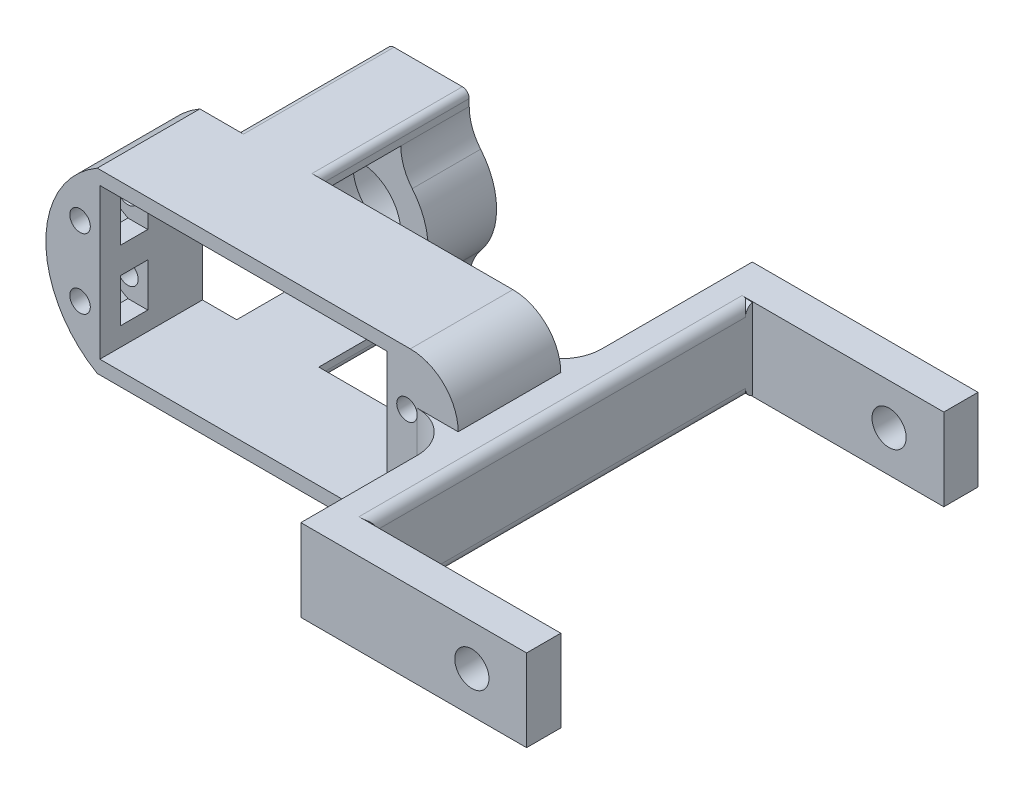
from build123d import *

# Parameters (mm, degrees)
ESQUISSE1_W                   = 80
ESQUISSE1_H                   = 26
BOSS_EXTRU_1_DEPTH            = 5
ESQUISSE4_W                   = 15
ESQUISSE4_H                   = 21
BOSS_EXTRU_2_DEPTH            = 23
ESQUISSE6_R                   = 1.9
ENL_V_MAT_EXTRU_1_DEPTH       = 23
ESQUISSE7_R                   = 2.5
ENL_V_MAT_EXTRU_2_DEPTH       = 33
ESQUISSE8_W                   = 23.844388633
ESQUISSE8_H                   = 15
ENL_V_MAT_EXTRU_3_DEPTH       = 20
ENL_V_MAT_EXTRU_4_DEPTH       = 20
ENL_V_MAT_EXTRU_5_DEPTH       = 25
ENL_V_MAT_EXTRU_7_DEPTH       = 25
ENL_V_MAT_EXTRU_8_DEPTH       = 1
BOSS_EXTRU_3_DEPTH            = 2
ESQUISSE15_R                  = 1.5
ENL_V_MAT_EXTRU_9_DEPTH       = 19
ENL_V_MAT_EXTRU_10_DEPTH      = 19
ESQUISSE17_W                  = 42
ESQUISSE17_H                  = 22
ENL_V_MAT_EXTRU_11_DEPTH      = 19
ENL_V_MAT_EXTRU_12_DEPTH      = 2
BOSS_EXTRU_4_DEPTH            = 22
BOSS_EXTRU_5_DEPTH            = 10
ESQUISSE25_R                  = 8
ENL_V_MAT_EXTRU_13_DEPTH      = 5
ESQUISSE26_R                  = 6
ENL_V_MAT_EXTRU_14_DEPTH      = 5
ENL_V_MAT_EXTRU_15_DEPTH      = 1
BOSS_EXTRU_6_DEPTH            = 2
ENL_V_MAT_EXTRU_16_DEPTH      = 25
ENL_V_MAT_EXTRU_16_DEPTH_BACK = 25
BOSS_EXTRU_7_START            = -5
BOSS_EXTRU_7_DEPTH            = 5
BOSS_EXTRU_8_DEPTH            = 23
BOSS_EXTRU_8_DEPTH_BACK       = 43
BOSS_EXTRU_10_DEPTH           = 45
BOSS_EXTRU_10_DEPTH_BACK      = 3
BOSS_EXTRU_12_DEPTH           = 5
ENL_V_START                   = -45
ENL_V_MAT_EXTRU_18_DEPTH      = 45
ESQUISSE41_W                  = 5
ESQUISSE41_H                  = 12
BOSS_EXTRU_13_DEPTH           = 37
ENL_V_MAT_EXTRU_19_DEPTH      = 2
ESQUISSE43_R                  = 2
ENL_V_MAT_EXTRU_20_DEPTH      = 18
ESQUISSE44_W                  = 24.601862261
ESQUISSE44_H                  = 37.157295415
ENL_V_MAT_EXTRU_21_DEPTH      = 18
BOSS_EXTRU_14_START           = -5
ESQUISSE45_R                  = 1.5
ESQUISSE45_R_2                = 1
BOSS_EXTRU_14_DEPTH           = 5
ENL_V_START_2                 = -29
ENL_V_MAT_EXTRU_22_DEPTH      = 29
ESQUISSE47_W                  = 0.149289857
ESQUISSE47_H                  = 9
ENL_V_MAT_EXTRU_23_DEPTH      = 1
ENL_V_MAT_EXTRU_24_DEPTH      = 21
ENL_V_MAT_EXTRU_24_DEPTH_BACK = 15
ESQUISSE48_W                  = 0.149289857
ESQUISSE48_H                  = 1
ENL_V_MAT_EXTRU_25_DEPTH      = 21
BOSS_EXTRU_15_DEPTH           = 12
ENL_V_MAT_EXTRU_26_DEPTH      = 13
ENL_V_MAT_EXTRU_26_DEPTH_BACK = 2
BOSS_EXTRU_16_DEPTH           = 2
ESQUISSE53_W                  = 7.470970304
ESQUISSE53_H                  = 6.350852961
ESQUISSE53_W_2                = 7.513906915
ESQUISSE53_W_3                = 7.72858997
ESQUISSE53_W_4                = 7.91407613
ENL_V_MAT_EXTRU_27_DEPTH      = 4
BOSS_EXTRU_17_DEPTH           = 8
BOSS_EXTRU_18_DEPTH           = 8
BOSS_EXTRU_19_DEPTH           = 12
ENL_V_START_3                 = -10
ESQUISSE58_R                  = 1.5
ENL_V_MAT_EXTRU_28_DEPTH      = 10
ENL_V_MAT_EXTRU_29_DEPTH      = 136.545455903
ENL_V_MAT_EXTRU_29_DEPTH_BACK = 136.545455903
ESQUISSE59_R                  = 2.5
ENL_V_MAT_EXTRU_30_DEPTH      = 136.545455903
ENL_V_MAT_EXTRU_30_DEPTH_BACK = 136.545455903
ESQUISSE60_W                  = 50
ESQUISSE60_H                  = 50


with BuildPart() as part:
    # Esquisse1 → Boss.-Extru.1 (new body)
    with BuildSketch(Plane.XY):
        with Locations((16.761307699, -3.439862543)):
            Rectangle(ESQUISSE1_W, ESQUISSE1_H)
    extrude(amount=BOSS_EXTRU_1_DEPTH)

    # Esquisse4 → Boss.-Extru.2 (add)
    with BuildSketch(Plane(origin=(0, 0, 0), x_dir=(-1, 0, 0), z_dir=(0, 0, -1))):
        with Locations((30.738692301, -3.439862543)):
            Rectangle(ESQUISSE4_W, ESQUISSE4_H)
    extrude(amount=-BOSS_EXTRU_2_DEPTH)

    # Esquisse6 → Enlèv. mat.-Extru.1 (cut)
    with BuildSketch(Plane.XZ.offset(13.939862543)):
        with Locations((-28.738692301, 5)):
            Circle(ESQUISSE6_R)
    extrude(amount=-ENL_V_MAT_EXTRU_1_DEPTH, mode=Mode.SUBTRACT)

    # Esquisse7 → Enlèv. mat.-Extru.2 (cut)
    with BuildSketch(Plane.XY.offset(23)):
        with Locations((-33.238692301, -3.439862543)):
            Circle(ESQUISSE7_R)
    extrude(amount=-ENL_V_MAT_EXTRU_2_DEPTH, mode=Mode.SUBTRACT)

    # Esquisse8 → Enlèv. mat.-Extru.3 (cut)
    with BuildSketch(Plane(origin=(0, 0, 0), x_dir=(-1, 0, 0), z_dir=(0, 0, -1))):
        with Locations((38.160886617, -3.439862543)):
            Rectangle(ESQUISSE8_W, ESQUISSE8_H)
    extrude(amount=-ENL_V_MAT_EXTRU_3_DEPTH, mode=Mode.SUBTRACT)

    # Esquisse9 → Enlèv. mat.-Extru.4 (cut)
    with BuildSketch(Plane(origin=(0, 0, 0), x_dir=(-1, 0, 0), z_dir=(0, 0, -1))):
        with BuildLine():
            Line((23.238692301, 7.060137457), (23.238692301, 9.560137457))
            Line((23.238692301, 9.560137457), (17.813492819, 9.560137457))
            ThreePointArc((17.813492819, 9.560137457), (20.800246467, 8.905073311), (23.238692301, 7.060137457))
        make_face()
        with BuildLine():
            Line((17.813492819, -16.439862543), (23.238692301, -16.439862543))
            Line((23.238692301, -16.439862543), (23.238692301, -13.939862543))
            ThreePointArc((23.238692301, -13.939862543), (20.800246467, -15.784798397), (17.813492819, -16.439862543))
        make_face()
    extrude(amount=-ENL_V_MAT_EXTRU_4_DEPTH, mode=Mode.SUBTRACT)

    # Esquisse10 → Enlèv. mat.-Extru.5 (cut)
    with BuildSketch(Plane.XZ.offset(13.939862543)):
        with BuildLine():
            Line((-23.238692301, 21.5), (-23.238692301, 23))
            Line((-23.238692301, 23), (-24.738692301, 23))
            ThreePointArc((-24.738692301, 23), (-23.678032129, 22.560660172), (-23.238692301, 21.5))
        make_face()
    extrude(amount=-ENL_V_MAT_EXTRU_5_DEPTH, mode=Mode.SUBTRACT)

    # Esquisse12 → Enlèv. mat.-Extru.7 (cut)
    with BuildSketch(Plane.XZ.offset(13.939862543)):
        with BuildLine():
            Line((-38.238692301, 23), (-36.738692301, 23))
            ThreePointArc((-36.738692301, 23), (-37.799352472, 22.560660172), (-38.238692301, 21.5))
            Line((-38.238692301, 21.5), (-38.238692301, 23))
        make_face()
    extrude(amount=-ENL_V_MAT_EXTRU_7_DEPTH, mode=Mode.SUBTRACT)

    # Esquisse13 → Enlèv. mat.-Extru.8 (cut)
    with BuildSketch(Plane(origin=(0, 7.060137457, 0), x_dir=(1, 0, 0), z_dir=(0, 1, 0))):
        Polygon((-30.759418243, -1.5), (-32.780144185, -5), (-30.759418243, -8.5), (-26.717966358, -8.5), (-24.697240416, -5), (-26.717966358, -1.5), align=None)
    extrude(amount=-ENL_V_MAT_EXTRU_8_DEPTH, mode=Mode.SUBTRACT)

    # Esquisse14 → Boss.-Extru.3 (add)
    with BuildSketch(Plane(origin=(0, 7.060137457, 0), x_dir=(1, 0, 0), z_dir=(0, 1, 0))):
        Polygon((-25.851940955, 0), (-31.625443646, 0), (-34.512194992, -5), (-31.625443646, -10), (-25.851940955, -10), (-23.238692301, -5.473720558), (-23.238692301, -4.526279442), align=None)
        Polygon((-30.759418243, -1.5), (-32.780144185, -5), (-30.759418243, -8.5), (-26.717966358, -8.5), (-24.697240416, -5), (-26.717966358, -1.5), align=None, mode=Mode.SUBTRACT)
    extrude(amount=BOSS_EXTRU_3_DEPTH)

    # Esquisse15 → Enlèv. mat.-Extru.9 (cut)
    with BuildSketch(Plane(origin=(0, 0, 0), x_dir=(-1, 0, 0), z_dir=(0, 0, -1))):
        with Locations((-51.761307699, -8.539862543)):
            Circle(ESQUISSE15_R)
        with Locations((-51.761307699, 1.660137457)):
            Circle(ESQUISSE15_R)
        with Locations((-3.961307699, -8.539862543)):
            Circle(ESQUISSE15_R)
        with Locations((-3.961307699, 1.660137457)):
            Circle(ESQUISSE15_R)
    extrude(amount=-ENL_V_MAT_EXTRU_9_DEPTH, mode=Mode.SUBTRACT)

    # Esquisse16 → Enlèv. mat.-Extru.10 (cut)
    with BuildSketch(Plane(origin=(0, 0, 0), x_dir=(-1, 0, 0), z_dir=(0, 0, -1))):
        with BuildLine():
            Line((-43.376442757, 11.472928569), (-43.376442757, 11.560137457))
            Line((-43.376442757, 11.560137457), (-70.792344678, 11.560137457))
            Line((-70.792344678, 11.560137457), (-70.792344678, -43.134117635))
            Line((-70.792344678, -43.134117635), (-43.376442757, -43.134117635))
            Line((-43.376442757, -43.134117635), (-43.376442757, -18.352653655))
            ThreePointArc((-43.376442757, -18.352653655), (-56.761307699, -3.439862543), (-43.376442757, 11.472928569))
        make_face()
    extrude(amount=-ENL_V_MAT_EXTRU_10_DEPTH, mode=Mode.SUBTRACT)

    # Esquisse17 → Enlèv. mat.-Extru.11 (cut)
    with BuildSketch(Plane.XY.offset(5)):
        with Locations((27.861307699, -3.439862543)):
            Rectangle(ESQUISSE17_W, ESQUISSE17_H)
    extrude(amount=-ENL_V_MAT_EXTRU_11_DEPTH, mode=Mode.SUBTRACT)

    # Esquisse18 → Enlèv. mat.-Extru.12 (cut)
    with BuildSketch(Plane(origin=(0, 0, 0), x_dir=(-1, 0, 0), z_dir=(0, 0, -1))):
        Polygon((-49.011307699, 3.247850697), (-51.761307699, 4.835563938), (-54.511307699, 3.247850697), (-54.511307699, 0.072424217), (-51.761307699, -1.515289023), (-49.011307699, 0.072424217), (-46.261307699, 1.660137457), align=None)
        Polygon((-49.011307699, -6.952149303), (-51.761307699, -5.364436062), (-54.511307699, -6.952149303), (-54.511307699, -10.127575783), (-51.761307699, -11.715289023), (-49.011307699, -10.127575783), (-46.261307699, -8.539862543), align=None)
        Polygon((-6.711307699, 0.072424217), (-9.461307699, 1.660137457), (-6.711307699, 3.247850697), (-3.961307699, 4.835563938), (-1.211307699, 3.247850697), (-1.211307699, 0.072424217), (-3.961307699, -1.515289023), align=None)
        Polygon((-9.461307699, -8.539862543), (-6.711307699, -6.952149303), (-3.961307699, -5.364436062), (-1.211307699, -6.952149303), (-1.211307699, -10.127575783), (-3.961307699, -11.715289023), (-6.711307699, -10.127575783), align=None)
    extrude(amount=-ENL_V_MAT_EXTRU_12_DEPTH, mode=Mode.SUBTRACT)

    # Esquisse19 → Boss.-Extru.4 (add)
    with BuildSketch(Plane(origin=(0, 0, 0), x_dir=(-1, 0, 0), z_dir=(0, 0, -1))):
        with BuildLine():
            Line((-12.861307699, -16.439862543), (-22.861307699, -16.439862543))
            ThreePointArc((-22.861307699, -16.439862543), (-23.568414481, -16.146969324), (-23.861307699, -15.439862543))
            Line((-23.861307699, -15.439862543), (-23.861307699, -14.439862543))
            Line((-23.861307699, -14.439862543), (-11.861307699, -14.439862543))
            Line((-11.861307699, -14.439862543), (-11.861307699, -15.439862543))
            ThreePointArc((-11.861307699, -15.439862543), (-12.154200918, -16.146969324), (-12.861307699, -16.439862543))
        make_face()
        with BuildLine():
            Line((-23.861307699, 8.560137457), (-23.861307699, 7.560137457))
            Line((-23.861307699, 7.560137457), (-11.861307699, 7.560137457))
            Line((-11.861307699, 7.560137457), (-11.861307699, 8.560137457))
            ThreePointArc((-11.861307699, 8.560137457), (-12.154200918, 9.267244238), (-12.861307699, 9.560137457))
            Line((-12.861307699, 9.560137457), (-22.861307699, 9.560137457))
            ThreePointArc((-22.861307699, 9.560137457), (-23.568414481, 9.267244238), (-23.861307699, 8.560137457))
        make_face()
    extrude(amount=BOSS_EXTRU_4_DEPTH)

    # Esquisse23 → Boss.-Extru.5 (add)
    with BuildSketch(Plane(origin=(0, 0, -22), x_dir=(-1, 0, 0), z_dir=(0, 0, -1))):
        with BuildLine():
            Line((-23.861307699, 8.560137457), (-23.861307699, 7.560137457))
            ThreePointArc((-23.861307699, 7.560137457), (-24.290279557, 5.125218133), (-25.525541276, 2.983495121))
            ThreePointArc((-25.525541276, 2.983495121), (-27.861307699, -3.439862543), (-25.525541276, -9.863220207))
            ThreePointArc((-25.525541276, -9.863220207), (-24.290279557, -12.004943218), (-23.861307699, -14.439862543))
            Line((-23.861307699, -14.439862543), (-23.861307699, -15.439862543))
            ThreePointArc((-23.861307699, -15.439862543), (-23.568414481, -16.146969324), (-22.861307699, -16.439862543))
            Line((-22.861307699, -16.439862543), (-12.861307699, -16.439862543))
            ThreePointArc((-12.861307699, -16.439862543), (-12.154200918, -16.146969324), (-11.861307699, -15.439862543))
            Line((-11.861307699, -15.439862543), (-11.861307699, -14.439862543))
            ThreePointArc((-11.861307699, -14.439862543), (-11.432335842, -12.004943218), (-10.197074123, -9.863220207))
            ThreePointArc((-10.197074123, -9.863220207), (-7.861307699, -3.439862543), (-10.197074123, 2.983495121))
            ThreePointArc((-10.197074123, 2.983495121), (-11.432335842, 5.125218133), (-11.861307699, 7.560137457))
            Line((-11.861307699, 7.560137457), (-11.861307699, 8.560137457))
            ThreePointArc((-11.861307699, 8.560137457), (-12.154200918, 9.267244238), (-12.861307699, 9.560137457))
            Line((-12.861307699, 9.560137457), (-22.861307699, 9.560137457))
            ThreePointArc((-22.861307699, 9.560137457), (-23.568414481, 9.267244238), (-23.861307699, 8.560137457))
        make_face()
    extrude(amount=BOSS_EXTRU_5_DEPTH)

    # Esquisse25 → Enlèv. mat.-Extru.13 (cut)
    with BuildSketch(Plane(origin=(0, 0, -32), x_dir=(-1, 0, 0), z_dir=(0, 0, -1))):
        with Locations((-17.861307699, -3.439862543)):
            Circle(ESQUISSE25_R)
    extrude(amount=-ENL_V_MAT_EXTRU_13_DEPTH, mode=Mode.SUBTRACT)

    # Esquisse26 → Enlèv. mat.-Extru.14 (cut)
    with BuildSketch(Plane(origin=(0, 0, -27), x_dir=(-1, 0, 0), z_dir=(0, 0, -1))):
        with Locations((-17.861307699, -3.439862543)):
            Circle(ESQUISSE26_R)
    extrude(amount=-ENL_V_MAT_EXTRU_14_DEPTH, mode=Mode.SUBTRACT)

    # Esquisse29 → Enlèv. mat.-Extru.15 (cut)
    with BuildSketch(Plane.XZ.offset(13.939862543)):
        Polygon((-26.717966358, 1.5), (-24.697240416, 5), (-26.717966358, 8.5), (-30.759418243, 8.5), (-32.780144185, 5), (-30.759418243, 1.5), align=None)
    extrude(amount=-ENL_V_MAT_EXTRU_15_DEPTH, mode=Mode.SUBTRACT)

    # Esquisse32 → Boss.-Extru.6 (add)
    with BuildSketch(Plane.XZ.offset(13.939862543)):
        Polygon((-25.851940955, 0), (-23.238692301, 4.526279442), (-23.238692301, 5.473720558), (-25.851940955, 10), (-31.625443646, 10), (-34.512194992, 5), (-31.625443646, 0), align=None)
        Polygon((-26.717966358, 1.5), (-24.697240416, 5), (-26.717966358, 8.5), (-30.759418243, 8.5), (-32.780144185, 5), (-30.759418243, 1.5), align=None, mode=Mode.SUBTRACT)
    extrude(amount=BOSS_EXTRU_6_DEPTH)

    # Esquisse33 → Enlèv. mat.-Extru.16 (cut, two sides: drawn at the far end of the back side and taken through both)
    with BuildSketch(Plane.XY.offset(5).offset(-ENL_V_MAT_EXTRU_16_DEPTH_BACK)):
        with BuildLine():
            Line((6.477992926, -16.439862543), (-54.7028229, -16.439862543))
            Line((-54.7028229, -16.439862543), (-54.7028229, 9.560137457))
            Line((-54.7028229, 9.560137457), (6.477992926, 9.560137457))
            ThreePointArc((6.477992926, 9.560137457), (-1.038692301, -3.439862543), (6.477992926, -16.439862543))
        make_face()
    extrude(amount=ENL_V_MAT_EXTRU_16_DEPTH + ENL_V_MAT_EXTRU_16_DEPTH_BACK, mode=Mode.SUBTRACT)

    # Esquisse34 → Boss.-Extru.7 (add)
    with BuildSketch(Plane.XY.offset(5).offset(BOSS_EXTRU_7_START)):
        with BuildLine():
            Line((59.244622473, -16.439862543), (49.244622473, -16.439862543))
            ThreePointArc((49.244622473, -16.439862543), (56.761307699, -3.439862543), (49.244622473, 9.560137457))
            Line((49.244622473, 9.560137457), (59.244622473, 9.560137457))
            Line((59.244622473, 9.560137457), (59.244622473, -16.439862543))
        make_face()
    extrude(amount=BOSS_EXTRU_7_DEPTH)

    # Esquisse35 → Boss.-Extru.8 (add, two sides: drawn at the far end of the back side and taken through both)
    with BuildSketch(Plane.XY.offset(5).offset(-BOSS_EXTRU_8_DEPTH_BACK)):
        with BuildLine():
            Line((62.744622473, -9.439862543), (59.244622473, -9.439862543))
            Line((59.244622473, -9.439862543), (59.244622473, 2.560137457))
            Line((59.244622473, 2.560137457), (62.744622473, 2.560137457))
            ThreePointArc((62.744622473, 2.560137457), (63.805282645, 2.120797629), (64.244622473, 1.060137457))
            Line((64.244622473, 1.060137457), (64.244622473, -7.939862543))
            ThreePointArc((64.244622473, -7.939862543), (63.805282645, -9.000522715), (62.744622473, -9.439862543))
        make_face()
    extrude(amount=BOSS_EXTRU_8_DEPTH + BOSS_EXTRU_8_DEPTH_BACK)

    # Esquisse36 → Boss.-Extru.10 (add, two sides: drawn at the far end of the back side and taken through both)
    with BuildSketch(Plane(origin=(64.244622473, 0, 0), x_dir=(0, 0, -1), z_dir=(1, 0, 0)).offset(-BOSS_EXTRU_10_DEPTH_BACK)):
        with BuildLine():
            Line((33.5, 2.560137457), (38, 2.560137457))
            Line((38, 2.560137457), (38, -9.439862543))
            Line((38, -9.439862543), (33.5, -9.439862543))
            ThreePointArc((33.5, -9.439862543), (32.439339828, -9.000522715), (32, -7.939862543))
            Line((32, -7.939862543), (32, 1.060137457))
            ThreePointArc((32, 1.060137457), (32.439339828, 2.120797629), (33.5, 2.560137457))
        make_face()
        with BuildLine():
            Line((-28, 2.560137457), (-28, -9.439862543))
            Line((-28, -9.439862543), (-23.5, -9.439862543))
            ThreePointArc((-23.5, -9.439862543), (-22.439339828, -9.000522715), (-22, -7.939862543))
            Line((-22, -7.939862543), (-22, 1.060137457))
            ThreePointArc((-22, 1.060137457), (-22.439339828, 2.120797629), (-23.5, 2.560137457))
            Line((-23.5, 2.560137457), (-28, 2.560137457))
        make_face()
    extrude(amount=BOSS_EXTRU_10_DEPTH + BOSS_EXTRU_10_DEPTH_BACK)

    # Esquisse39 → Boss.-Extru.12 (add)
    with BuildSketch(Plane(origin=(0, 0, -38), x_dir=(-1, 0, 0), z_dir=(0, 0, -1))):
        with BuildLine():
            Line((-77.712666699, 2.560137457), (-100.293632227, 2.560137457))
            add(Edge.make_bspline(
                [(-101.462740863, -1.584513895), (-99.224121261, -2.268014786), (-102.465356223, 2.979290843), (-100.293632227, 2.560137457)],
                knots=[0, 0, 0, 0, 0.141370549, 0.141370549, 0.141370549, 0.141370549], degree=3))
            ThreePointArc((-101.462740863, -1.584513895), (-117.244622473, -3.439862543), (-101.462740863, -5.295211191))
            add(Edge.make_bspline(
                [(-101.462740863, -5.295211191), (-99.224121261, -4.6117103), (-102.465356223, -9.859015928), (-100.293632227, -9.439862543)],
                knots=[0, 0, 0, 0, 0.141370549, 0.141370549, 0.141370549, 0.141370549], degree=3))
            Line((-100.293632227, -9.439862543), (-77.712666699, -9.439862543))
            Line((-77.712666699, -9.439862543), (-77.712666699, 2.560137457))
        make_face()
    extrude(amount=-BOSS_EXTRU_12_DEPTH)

    # Esquisse40 → Enlèv. mat.-Extru.18 (cut)
    with BuildSketch(Plane(origin=(109.244622473, 0, 0), x_dir=(0, 0, -1), z_dir=(1, 0, 0)).offset(ENL_V_START)):
        with BuildLine():
            Line((32, 1.060137457), (32, -7.939862543))
            ThreePointArc((32, -7.939862543), (32.275255129, -8.805887947), (33, -9.354076105))
            Line((33, -9.354076105), (33, 2.474351019))
            ThreePointArc((33, 2.474351019), (32.275255129, 1.926162861), (32, 1.060137457))
        make_face()
    extrude(amount=ENL_V_MAT_EXTRU_18_DEPTH, mode=Mode.SUBTRACT)

    # Esquisse41 → Boss.-Extru.13 (add)
    with BuildSketch(Plane.ZY.offset(-59.244622473)):
        with Locations((-35.5, -3.439862543)):
            Rectangle(ESQUISSE41_W, ESQUISSE41_H)
    extrude(amount=-BOSS_EXTRU_13_DEPTH)

    # Esquisse42 → Enlèv. mat.-Extru.19 (cut)
    with BuildSketch(Plane.XY.offset(-33)):
        Polygon((105.744622473, -5.460588485), (109.244622473, -7.481314427), (112.744622473, -5.460588485), (112.744622473, -1.419136601), (109.244622473, 0.601589341), (105.744622473, -1.419136601), align=None)
    extrude(amount=-ENL_V_MAT_EXTRU_19_DEPTH, mode=Mode.SUBTRACT)

    # Esquisse43 → Enlèv. mat.-Extru.20 (cut)
    with BuildSketch(Plane(origin=(0, 0, -38), x_dir=(-1, 0, 0), z_dir=(0, 0, -1))):
        with Locations((-109.244622473, -3.439862543)):
            Circle(ESQUISSE43_R)
    extrude(amount=-ENL_V_MAT_EXTRU_20_DEPTH, mode=Mode.SUBTRACT)

    # Esquisse44 → Enlèv. mat.-Extru.21 (cut)
    with BuildSketch(Plane.XY.offset(28)):
        with Locations((105.694843461, -5.730380753)):
            Rectangle(ESQUISSE44_W, ESQUISSE44_H)
    extrude(amount=-ENL_V_MAT_EXTRU_21_DEPTH, mode=Mode.SUBTRACT)

    # Esquisse45 → Boss.-Extru.14 (add)
    with BuildSketch(Plane.XY.offset(28).offset(BOSS_EXTRU_14_START)):
        with BuildLine():
            Line((63.244622473, 2.474351019), (64.244622473, 2.474351019))
            Line((64.244622473, 2.474351019), (64.244622473, -9.354076105))
            Line((64.244622473, -9.354076105), (63.244622473, -9.354076105))
            ThreePointArc((63.244622473, -9.354076105), (62.998275441, -9.418260382), (62.744622473, -9.439862543))
            Line((62.744622473, -9.439862543), (100.293632227, -9.439862543))
            add(Edge.make_bspline(
                [(100.293632227, -9.439862543), (100.565101811, -9.492257504), (100.751991366, -9.45611138), (100.875576879, -9.3540761)],
                knots=[0.123698964, 0.123698964, 0.123698964, 0.123698964, 0.141370549, 0.141370549, 0.141370549, 0.141370549], degree=3))
            Line((100.875576879, -9.3540761), (103.857408171, -9.354076105))
            ThreePointArc((103.857408171, -9.354076105), (117.244622473, -3.439862543), (103.857408171, 2.474351019))
            Line((103.857408171, 2.474351019), (100.875576879, 2.474351014))
            add(Edge.make_bspline(
                [(100.875576879, 2.474351014), (100.751991366, 2.576386294), (100.565101811, 2.612532419), (100.293632227, 2.560137457)],
                knots=[0, 0, 0, 0, 0.017671584, 0.017671584, 0.017671584, 0.017671584], degree=3))
            Line((100.293632227, 2.560137457), (62.744622473, 2.560137457))
            ThreePointArc((62.744622473, 2.560137457), (62.998275441, 2.538535297), (63.244622473, 2.474351019))
        make_face()
        with Locations((109.244622473, -3.439862543)):
            Circle(ESQUISSE45_R, mode=Mode.SUBTRACT)
        with Locations((98.894622473, -3.439862543)):
            Circle(ESQUISSE45_R_2, mode=Mode.SUBTRACT)
    extrude(amount=BOSS_EXTRU_14_DEPTH)

    # Esquisse46 → Enlèv. mat.-Extru.22 (cut)
    with BuildSketch(Plane(origin=(93.39391233, 0, 0), x_dir=(0, 0, -1), z_dir=(1, 0, 0)).offset(ENL_V_START_2)):
        with BuildLine():
            Line((-23, 2.474351019), (-23, -9.354076105))
            ThreePointArc((-23, -9.354076105), (-22.275255129, -8.805887947), (-22, -7.939862543))
            Line((-22, -7.939862543), (-22, 1.060137457))
            ThreePointArc((-22, 1.060137457), (-22.275255129, 1.926162861), (-23, 2.474351019))
        make_face()
    extrude(amount=ENL_V_MAT_EXTRU_22_DEPTH, mode=Mode.SUBTRACT)

    # Esquisse47 → Enlèv. mat.-Extru.23 (cut)
    with BuildSketch(Plane(origin=(0, 0, 22), x_dir=(-1, 0, 0), z_dir=(0, 0, -1))):
        with Locations((-64.319267402, -3.439862543)):
            Rectangle(ESQUISSE47_W, ESQUISSE47_H)
    extrude(amount=-ENL_V_MAT_EXTRU_23_DEPTH, mode=Mode.SUBTRACT)

    # Esquisse48 → Enlèv. mat.-Extru.24 (cut, two sides: drawn at the far end of the back side and taken through both)
    with BuildSketch(Plane.XZ.offset(-1.060137457).offset(-ENL_V_MAT_EXTRU_24_DEPTH_BACK)):
        with Locations((64.319267402, 22.5)):
            Rectangle(ESQUISSE48_W, ESQUISSE48_H)
    extrude(amount=ENL_V_MAT_EXTRU_24_DEPTH + ENL_V_MAT_EXTRU_24_DEPTH_BACK, mode=Mode.SUBTRACT)

    # Esquisse49 → Enlèv. mat.-Extru.25 (cut)
    with BuildSketch(Plane.XY.offset(5)):
        with BuildLine():
            Line((59.244622473, -9.439862543), (59.244622473, -16.439862543))
            Line((59.244622473, -16.439862543), (52.244622473, -16.439862543))
            ThreePointArc((52.244622473, -16.439862543), (57.194369941, -14.389610011), (59.244622473, -9.439862543))
        make_face()
        with BuildLine():
            Line((59.244622473, 9.560137457), (52.244622473, 9.560137457))
            ThreePointArc((52.244622473, 9.560137457), (57.194369941, 7.509884925), (59.244622473, 2.560137457))
            Line((59.244622473, 2.560137457), (59.244622473, 9.560137457))
        make_face()
    extrude(amount=-ENL_V_MAT_EXTRU_25_DEPTH, mode=Mode.SUBTRACT)

    # Esquisse50 → Boss.-Extru.15 (add)
    with BuildSketch(Plane(origin=(0, 2.560137457, 0), x_dir=(1, 0, 0), z_dir=(0, 1, 0))):
        with BuildLine():
            Line((59.244622473, 5.983314774), (59.244622473, -10.983314774))
            ThreePointArc((59.244622473, -10.983314774), (57.49215015, -6.752472323), (53.261307699, -5))
            Line((53.261307699, -5), (53.261307699, 0))
            ThreePointArc((53.261307699, 0), (57.49215015, 1.752472323), (59.244622473, 5.983314774))
        make_face()
    extrude(amount=-BOSS_EXTRU_15_DEPTH)

    # Esquisse51 → Enlèv. mat.-Extru.26 (cut, two sides: drawn at the far end of the back side and taken through both)
    with BuildSketch(Plane(origin=(0, 0, 0), x_dir=(-1, 0, 0), z_dir=(0, 0, -1)).offset(-ENL_V_MAT_EXTRU_26_DEPTH_BACK)):
        Polygon((-49.011307699, -10.127575783), (-49.011307699, -6.952149303), (-51.761307699, -5.364436062), (-54.511307699, -6.952149303), (-54.511307699, -10.127575783), (-51.761307699, -11.715289023), align=None)
        Polygon((-49.011307699, 3.247850697), (-51.761307699, 4.835563938), (-54.511307699, 3.247850697), (-54.511307699, 0.072424217), (-51.761307699, -1.515289023), (-49.011307699, 0.072424217), align=None)
    extrude(amount=ENL_V_MAT_EXTRU_26_DEPTH + ENL_V_MAT_EXTRU_26_DEPTH_BACK, mode=Mode.SUBTRACT)

    # Esquisse52 → Boss.-Extru.16 (add)
    with BuildSketch(Plane(origin=(0, 0, 0), x_dir=(-1, 0, 0), z_dir=(0, 0, -1))):
        with BuildLine():
            Line((-59.244622473, 2.560137457), (-54.511307699, 2.560137457))
            Line((-54.511307699, 2.560137457), (-54.511307699, 3.247850697))
            Line((-54.511307699, 3.247850697), (-51.761307699, 4.835563938))
            Line((-51.761307699, 4.835563938), (-48.861307699, 3.161248157))
            Line((-48.861307699, 3.161248157), (-48.861307699, 7.560137457))
            Line((-48.861307699, 7.560137457), (-23.861307699, 7.560137457))
            Line((-23.861307699, 7.560137457), (-23.861307699, 8.560137457))
            ThreePointArc((-23.861307699, 8.560137457), (-23.568414481, 9.267244238), (-22.861307699, 9.560137457))
            Line((-22.861307699, 9.560137457), (-52.244622473, 9.560137457))
            ThreePointArc((-52.244622473, 9.560137457), (-57.194369941, 7.509884925), (-59.244622473, 2.560137457))
        make_face()
        Polygon((-51.761307699, -1.515289023), (-53.261307699, -0.64926362), (-53.261307699, -6.230461466), (-51.761307699, -5.364436062), (-48.861307699, -7.038751843), (-48.861307699, 0.159026757), align=None)
        with BuildLine():
            Line((-54.511307699, -9.439862543), (-59.244622473, -9.439862543))
            ThreePointArc((-59.244622473, -9.439862543), (-57.194369941, -14.389610011), (-52.244622473, -16.439862543))
            Line((-52.244622473, -16.439862543), (-22.861307699, -16.439862543))
            ThreePointArc((-22.861307699, -16.439862543), (-23.568414481, -16.146969324), (-23.861307699, -15.439862543))
            Line((-23.861307699, -15.439862543), (-23.861307699, -14.439862543))
            Line((-23.861307699, -14.439862543), (-48.861307699, -14.439862543))
            Line((-48.861307699, -14.439862543), (-48.861307699, -10.040973243))
            Line((-48.861307699, -10.040973243), (-51.761307699, -11.715289023))
            Line((-51.761307699, -11.715289023), (-54.511307699, -10.127575783))
            Line((-54.511307699, -10.127575783), (-54.511307699, -9.439862543))
        make_face()
        with BuildLine():
            Line((-12.861307699, -16.439862543), (-6.477992926, -16.439862543))
            ThreePointArc((-6.477992926, -16.439862543), (1.038692301, -3.439862543), (-6.477992926, 9.560137457))
            Line((-6.477992926, 9.560137457), (-12.861307699, 9.560137457))
            ThreePointArc((-12.861307699, 9.560137457), (-12.154200918, 9.267244238), (-11.861307699, 8.560137457))
            Line((-11.861307699, 8.560137457), (-11.861307699, 7.560137457))
            Line((-11.861307699, 7.560137457), (-6.861307699, 7.560137457))
            Line((-6.861307699, 7.560137457), (-6.861307699, 3.161248157))
            Line((-6.861307699, 3.161248157), (-3.961307699, 4.835563938))
            Line((-3.961307699, 4.835563938), (-1.211307699, 3.247850697))
            Line((-1.211307699, 3.247850697), (-1.211307699, 0.072424217))
            Line((-1.211307699, 0.072424217), (-3.961307699, -1.515289023))
            Line((-3.961307699, -1.515289023), (-6.861307699, 0.159026757))
            Line((-6.861307699, 0.159026757), (-6.861307699, -7.038751843))
            Line((-6.861307699, -7.038751843), (-3.961307699, -5.364436062))
            Line((-3.961307699, -5.364436062), (-1.211307699, -6.952149303))
            Line((-1.211307699, -6.952149303), (-1.211307699, -10.127575783))
            Line((-1.211307699, -10.127575783), (-3.961307699, -11.715289023))
            Line((-3.961307699, -11.715289023), (-6.861307699, -10.040973243))
            Line((-6.861307699, -10.040973243), (-6.861307699, -14.439862543))
            Line((-6.861307699, -14.439862543), (-11.861307699, -14.439862543))
            Line((-11.861307699, -14.439862543), (-11.861307699, -15.439862543))
            ThreePointArc((-11.861307699, -15.439862543), (-12.154200918, -16.146969324), (-12.861307699, -16.439862543))
        make_face()
    extrude(amount=BOSS_EXTRU_16_DEPTH)

    # Esquisse53 → Enlèv. mat.-Extru.27 (cut)
    with BuildSketch(Plane(origin=(0, 0, -2), x_dir=(-1, 0, 0), z_dir=(0, 0, -1))):
        with Locations((-48.025822547, 1.660137457)):
            Rectangle(ESQUISSE53_W, ESQUISSE53_H)
        with Locations((-48.004354242, -8.539862542)):
            Rectangle(ESQUISSE53_W_2, ESQUISSE53_H)
        with Locations((-7.825602684, 1.660137457)):
            Rectangle(ESQUISSE53_W_3, ESQUISSE53_H)
        with Locations((-7.918345764, -8.539862542)):
            Rectangle(ESQUISSE53_W_4, ESQUISSE53_H)
    extrude(amount=-ENL_V_MAT_EXTRU_27_DEPTH, mode=Mode.SUBTRACT)

    # Esquisse54 → Boss.-Extru.17 (add)
    with BuildSketch(Plane(origin=(0, 0, -2), x_dir=(-1, 0, 0), z_dir=(0, 0, -1))):
        with BuildLine():
            Line((-6.861307699, 4.835563938), (-6.861307699, -11.715289023))
            Line((-6.861307699, -11.715289023), (-6.861307699, -14.439862543))
            Line((-6.861307699, -14.439862543), (-11.861307699, -14.439862543))
            Line((-11.861307699, -14.439862543), (-11.861307699, -15.439862543))
            ThreePointArc((-11.861307699, -15.439862543), (-12.154200918, -16.146969324), (-12.861307699, -16.439862543))
            Line((-12.861307699, -16.439862543), (-6.477992926, -16.439862543))
            ThreePointArc((-6.477992926, -16.439862543), (1.038692301, -3.439862543), (-6.477992926, 9.560137457))
            Line((-6.477992926, 9.560137457), (-12.861307699, 9.560137457))
            ThreePointArc((-12.861307699, 9.560137457), (-12.154200918, 9.267244238), (-11.861307699, 8.560137457))
            Line((-11.861307699, 8.560137457), (-11.861307699, 7.560137457))
            Line((-11.861307699, 7.560137457), (-6.861307699, 7.560137457))
            Line((-6.861307699, 7.560137457), (-6.861307699, 4.835563938))
        make_face()
    extrude(amount=BOSS_EXTRU_17_DEPTH)

    # Esquisse56 → Boss.-Extru.18 (add)
    with BuildSketch(Plane(origin=(0, 0, -2), x_dir=(-1, 0, 0), z_dir=(0, 0, -1))):
        with BuildLine():
            Line((-48.861307699, 7.560137457), (-48.861307699, -14.439862543))
            Line((-48.861307699, -14.439862543), (-23.861307699, -14.439862543))
            Line((-23.861307699, -14.439862543), (-23.861307699, -15.439862543))
            ThreePointArc((-23.861307699, -15.439862543), (-23.568414481, -16.146969324), (-22.861307699, -16.439862543))
            Line((-22.861307699, -16.439862543), (-52.244622473, -16.439862543))
            ThreePointArc((-52.244622473, -16.439862543), (-57.194369941, -14.389610011), (-59.244622473, -9.439862543))
            Line((-59.244622473, -9.439862543), (-59.244622473, 2.560137457))
            ThreePointArc((-59.244622473, 2.560137457), (-57.194369941, 7.509884925), (-52.244622473, 9.560137457))
            Line((-52.244622473, 9.560137457), (-22.861307699, 9.560137457))
            ThreePointArc((-22.861307699, 9.560137457), (-23.568414481, 9.267244238), (-23.861307699, 8.560137457))
            Line((-23.861307699, 8.560137457), (-23.861307699, 7.560137457))
            Line((-23.861307699, 7.560137457), (-48.861307699, 7.560137457))
        make_face()
    extrude(amount=BOSS_EXTRU_18_DEPTH)

    # Esquisse57 → Boss.-Extru.19 (add)
    with BuildSketch(Plane(origin=(0, 2.560137457, 0), x_dir=(1, 0, 0), z_dir=(0, 1, 0))):
        with BuildLine():
            Line((59.244622473, 15.983314774), (59.244622473, 16.594927039))
            Line((59.244622473, 16.594927039), (60.38387284, 14.424847957))
            Line((60.38387284, 14.424847957), (59.244622473, 6.995007288))
            Line((59.244622473, 6.995007288), (59.244622473, 10))
            Line((59.244622473, 10), (53.261307699, 10))
            ThreePointArc((53.261307699, 10), (57.49215015, 11.752472323), (59.244622473, 15.983314774))
        make_face()
    extrude(amount=-BOSS_EXTRU_19_DEPTH)

    # Esquisse58 → Enlèv. mat.-Extru.28 (cut)
    with BuildSketch(Plane.XY.offset(5).offset(ENL_V_START_3)):
        with Locations(Location((3.961307699, 1.660137457, 0), (0, 0, 180))):
            Circle(ESQUISSE58_R)
        with Locations((3.961307699, -8.539862543)):
            Circle(ESQUISSE58_R)
        with Locations(Location((51.761307699, 1.660137457, 0), (0, 0, 180))):
            Circle(ESQUISSE58_R)
        with Locations(Location((51.761307699, -8.539862543, 0), (0, 0, 180))):
            Circle(ESQUISSE58_R)
    extrude(amount=ENL_V_MAT_EXTRU_28_DEPTH, mode=Mode.SUBTRACT)

    # Esquisse59 → Enlèv. mat.-Extru.29 (cut, two sides: drawn at the far end of the back side and taken through both)
    with BuildSketch(Plane(origin=(0, 0, -38), x_dir=(-1, 0, 0), z_dir=(0, 0, -1)).offset(-ENL_V_MAT_EXTRU_29_DEPTH_BACK)):
        with Locations((-84.244622473, -3.439862543)):
            Circle(ESQUISSE59_R)
    extrude(amount=ENL_V_MAT_EXTRU_29_DEPTH + ENL_V_MAT_EXTRU_29_DEPTH_BACK, mode=Mode.SUBTRACT)

    # Esquisse60 → Enlèv. mat.-Extru.30 (cut, two sides: drawn at the far end of the back side and taken through both)
    with BuildSketch(Plane(origin=(0, 0, -38), x_dir=(-1, 0, 0), z_dir=(0, 0, -1)).offset(-ENL_V_MAT_EXTRU_30_DEPTH_BACK)):
        with Locations((-117.244622473, -3.439862543)):
            Rectangle(ESQUISSE60_W, ESQUISSE60_H)
    extrude(amount=ENL_V_MAT_EXTRU_30_DEPTH + ENL_V_MAT_EXTRU_30_DEPTH_BACK, mode=Mode.SUBTRACT)


solid = part.part
